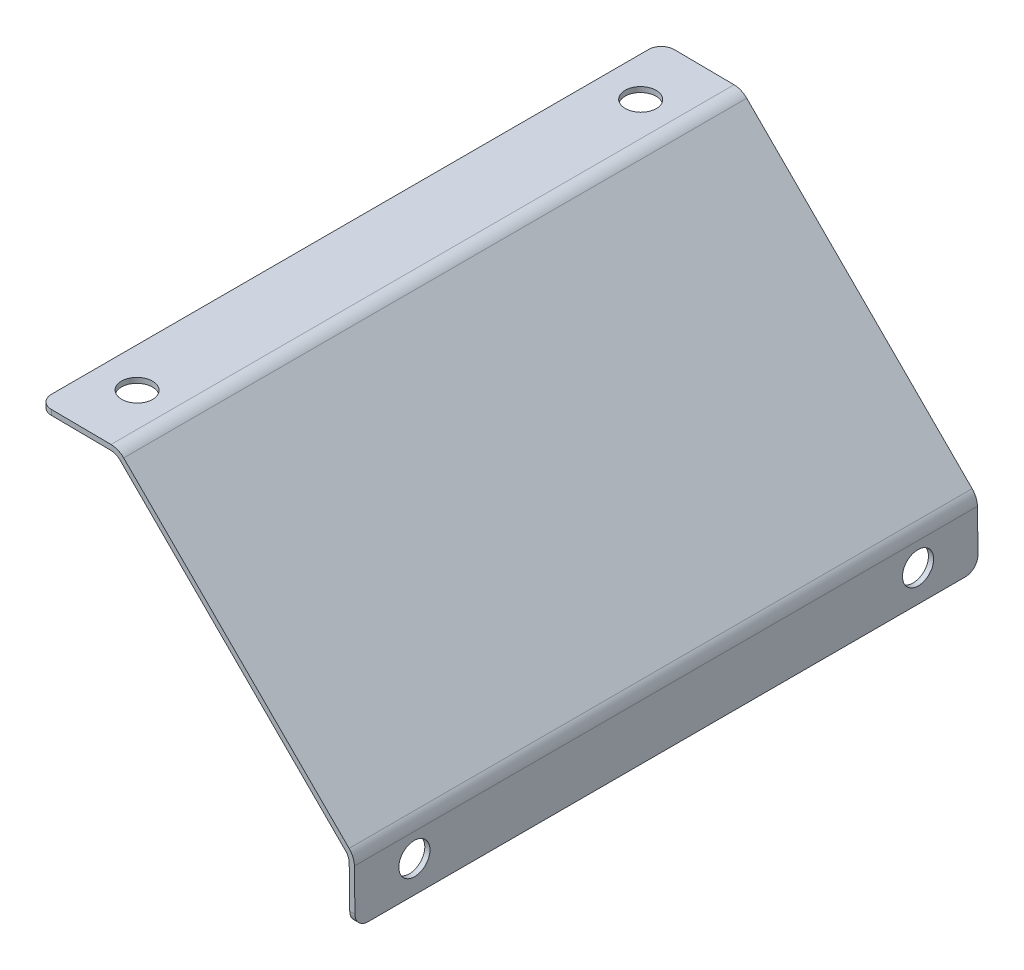
from build123d import *

# Parameters (mm, degrees)
ESTRUSIONE_SOTTILE1_DEPTH      = 120
ESTRUSIONE_SOTTILE1_DEPTH_BACK = 120
RACCORDO1_R                    = 5
RACCORDO2_R                    = 5
SCHIZZO8_R                     = 6
TAGLIO_ESTRUSIONE1_DEPTH       = 210.306999049
SCHIZZO7_R                     = 6
TAGLIO_ESTRUSIONE2_DEPTH       = 206.470737868


with BuildPart() as part:
    # Schizzo1 → Estrusione-Sottile1 (new, two sides: drawn at the far end of the back side and taken through both)
    with BuildSketch(Plane.XY.offset(-ESTRUSIONE_SOTTILE1_DEPTH_BACK)):
        with BuildLine():
            Line((0, 120), (27.957459223, 119.728070778))
            ThreePointArc((27.957459223, 119.728070778), (29.844687952, 119.338345184), (31.444362752, 118.263841181))
            Line((31.444362752, 118.263841181), (118.269943122, 31.43826081))
            ThreePointArc((118.269943122, 31.43826081), (119.341577126, 29.845406459), (119.734006879, 27.966155728))
            Line((119.734006879, 27.966155728), (120, 7))
            Line((120, 7), (121.999839065, 7.025371529))
            Line((121.999839065, 7.025371529), (121.733845944, 27.991527257))
            ThreePointArc((121.733845944, 27.991527257), (121.18444429, 30.622478281), (119.684156685, 32.852474373))
            Line((119.684156685, 32.852474373), (32.858576314, 119.678054743))
            ThreePointArc((32.858576314, 119.678054743), (30.619031595, 121.182360347), (27.976911374, 121.727976179))
            Line((27.976911374, 121.727976179), (0.019452151, 121.999905401))
            Line((0.019452151, 121.999905401), (0, 120))
        make_face()
    extrude(amount=ESTRUSIONE_SOTTILE1_DEPTH + ESTRUSIONE_SOTTILE1_DEPTH_BACK)

    # Raccordo1
    raccordo1_edges = [part.edges().sort_by_distance(p)[0] for p in [
        (120.999919532, 7.012685765, 120),
        (120.999919532, 7.012685765, -120),
    ]]
    fillet(raccordo1_edges, radius=RACCORDO1_R)

    # Raccordo2
    raccordo2_edges = [part.edges().sort_by_distance(p)[0] for p in [
        (0.009726076, 120.999952701, 120),
        (0.009726076, 120.999952701, -120),
    ]]
    fillet(raccordo2_edges, radius=RACCORDO2_R)

    # Schizzo8 → Taglio-Estrusione1 (cut, through all)
    with BuildSketch(Plane(origin=(122.069320837, 1.548667295, 0), x_dir=(0, 0, -1), z_dir=(0.9999195324498686, 0.012685764668954389, 0))):
        with Locations(Location((-97, 17.476179356, 0), (0, 0, 90))):
            Circle(SCHIZZO8_R)
        with Locations(Location((97, 17.476179356, 0), (0, 0, 90))):
            Circle(SCHIZZO8_R)
    extrude(amount=-TAGLIO_ESTRUSIONE1_DEPTH, mode=Mode.SUBTRACT)

    # Schizzo7 → Taglio-Estrusione2 (cut, through all)
    with BuildSketch(Plane(origin=(1.186526009, 121.988553816, 0), x_dir=(0.9999527006088332, -0.00972607552414292, 0), z_dir=(0.00972607552414292, 0.9999527006088332, 0))):
        with Locations(Location((13.832161446, -97, 0), (0, 0, 180))):
            Circle(SCHIZZO7_R)
        with Locations(Location((13.832161446, 97, 0), (0, 0, 180))):
            Circle(SCHIZZO7_R)
    extrude(amount=-TAGLIO_ESTRUSIONE2_DEPTH, mode=Mode.SUBTRACT)


solid = part.part
